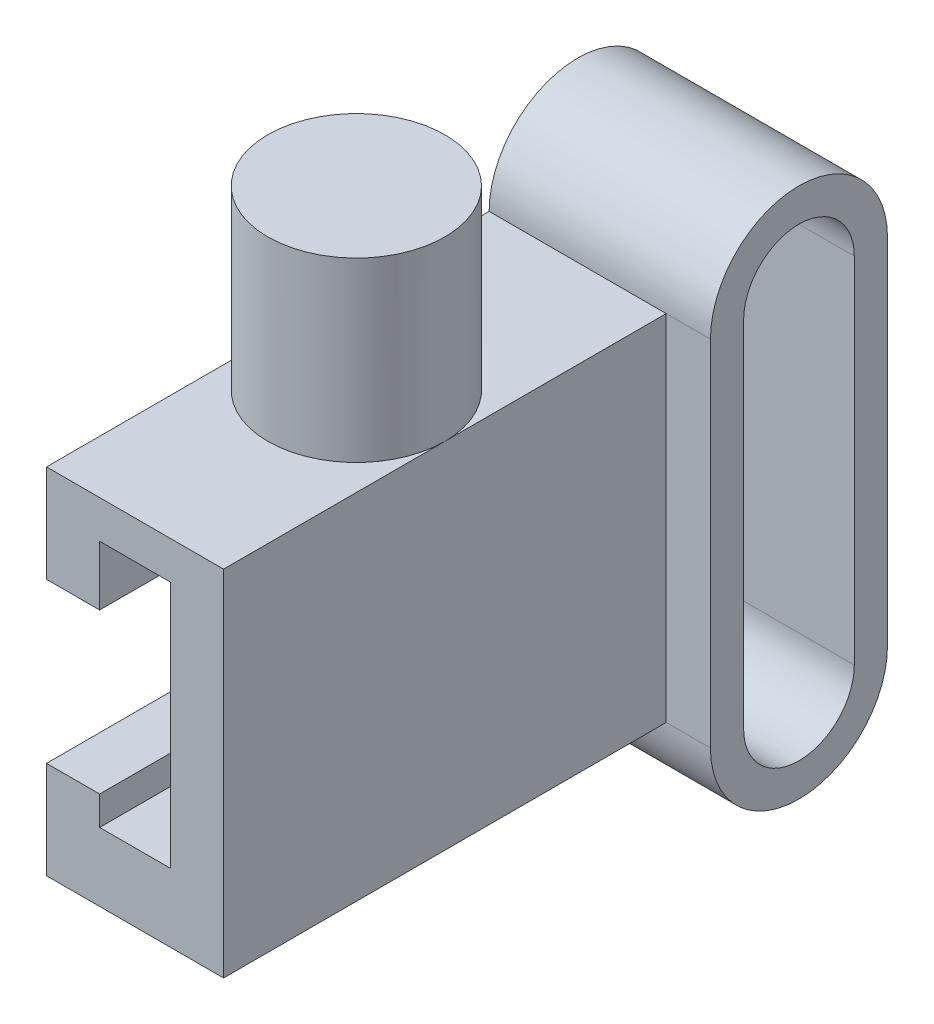
from build123d import *

# Parameters (mm, degrees)
BOSS_EXTRUDE1_DEPTH = 50
BOSS_EXTRUDE2_DEPTH = 100
SKETCH4_R           = 20
BOSS_EXTRUDE3_DEPTH = 40


with BuildPart() as part:
    # Sketch2 → Boss-Extrude1 (new body)
    with BuildSketch(Plane(origin=(0, 0, 0), x_dir=(0, 0, -1), z_dir=(1, 0, 0))):
        with BuildLine():
            Line((-20, 40), (-20, -40))
            ThreePointArc((-20, -40), (0, -60), (20, -40))
            Line((20, -40), (20, 40))
            ThreePointArc((20, 40), (0, 60), (-20, 40))
        make_face()
        with BuildLine():
            Line((-12.5, 40), (-12.5, -40))
            ThreePointArc((-12.5, -40), (0, -52.5), (12.5, -40))
            Line((12.5, -40), (12.5, 40))
            ThreePointArc((12.5, 40), (0, 52.5), (-12.5, 40))
        make_face(mode=Mode.SUBTRACT)
    extrude(amount=-BOSS_EXTRUDE1_DEPTH)

    # Sketch3 → Boss-Extrude2 (add)
    with BuildSketch(Plane.XY.offset(20)):
        Polygon((-50, 40), (-10, 40), (-10, -40), (-50, -40), (-50, -18), (-38, -18), (-38, -24.542301432), (-22, -24.542301432), (-22, 31.457698568), (-38, 31.457698568), (-38, 18), (-50, 18), align=None)
    extrude(amount=BOSS_EXTRUDE2_DEPTH)

    # Sketch4 → Boss-Extrude3 (add)
    with BuildSketch(Plane(origin=(0, 40, 0), x_dir=(1, 0, 0), z_dir=(0, 1, 0))):
        with Locations(Location((-30, -70, 0), (0, 0, 180))):
            Circle(SKETCH4_R)
    extrude(amount=BOSS_EXTRUDE3_DEPTH)


solid = part.part
